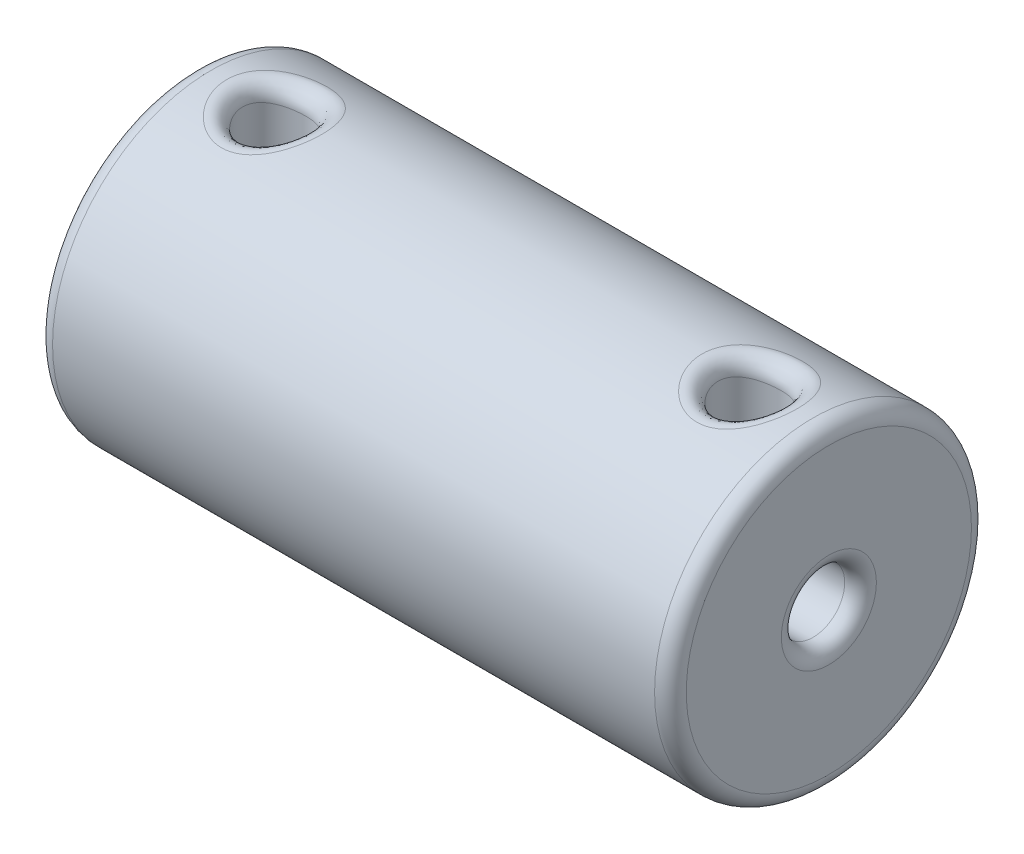
from build123d import *

# Parameters (mm, degrees)
BOSS_EXTRUDE1_DEPTH      = 10
BOSS_EXTRUDE1_DEPTH_BACK = 10
SKETCH1_R                = 5
SKETCH2_R                = 1
CUT_EXTRUDE1_DEPTH       = 10
SKETCH3_R                = 2
CUT_EXTRUDE2_DEPTH       = 10
CUT_EXTRUDE4_REACH       = 14.247
SKETCH4_R                = 1
FILLET1_R                = 0.5
FILLET2_R                = 0.5


with BuildPart() as part:
    # Sketch1 → Boss-Extrude1 (new, two sides: drawn at the far end of the back side and taken through both)
    with BuildSketch(Plane(origin=(0, 0, 0), x_dir=(0, 0, -1), z_dir=(1, 0, 0)).offset(-BOSS_EXTRUDE1_DEPTH_BACK)):
        Circle(SKETCH1_R)
    extrude(amount=BOSS_EXTRUDE1_DEPTH + BOSS_EXTRUDE1_DEPTH_BACK)

    # Sketch2 → Cut-Extrude1 (cut)
    with BuildSketch(Plane(origin=(10, 0, 0), x_dir=(0, 0, -1), z_dir=(1, 0, 0))):
        Circle(SKETCH2_R)
    extrude(amount=-CUT_EXTRUDE1_DEPTH, mode=Mode.SUBTRACT)

    # Sketch3 → Cut-Extrude2 (cut)
    with BuildSketch(Plane.ZY.offset(10)):
        Circle(SKETCH3_R)
    extrude(amount=-CUT_EXTRUDE2_DEPTH, mode=Mode.SUBTRACT)

    # Sketch4 → Cut-Extrude4 (cut, up to next)
    with BuildSketch(Plane(origin=(0, 0, 0), x_dir=(1, 0, 0), z_dir=(0, 1, 0)), mode=Mode.PRIVATE) as cut_extrude4_sk1:
        with Locations((-7.5, 0)):
            Circle(SKETCH4_R)
    cut_extrude4_tool1 = extrude(cut_extrude4_sk1.sketch, amount=CUT_EXTRUDE4_REACH, mode=Mode.PRIVATE) & part.part
    # Sketch4 → Cut-Extrude4 (cut, up to next)
    with BuildSketch(Plane(origin=(0, 0, 0), x_dir=(1, 0, 0), z_dir=(0, 1, 0)), mode=Mode.PRIVATE) as cut_extrude4_sk2:
        with Locations((7.5, 0)):
            Circle(SKETCH4_R)
    cut_extrude4_tool2 = extrude(cut_extrude4_sk2.sketch, amount=CUT_EXTRUDE4_REACH, mode=Mode.PRIVATE) & part.part
    add(cut_extrude4_tool1.solids().sort_by_distance((-7.5, 0, 0))[0], mode=Mode.SUBTRACT)
    add(cut_extrude4_tool2.solids().sort_by_distance((7.5, 0, 0))[0], mode=Mode.SUBTRACT)

    # Fillet1
    fillet1_edges = [part.edges().sort_by_distance(p)[0] for p in [
        (10, 0, 1),
        (10, 0, 5),
        (-10, 0, 5),
        (-10, 0, -2),
    ]]
    fillet(fillet1_edges, radius=FILLET1_R)

    # Fillet2
    fillet2_edges = [part.edges().sort_by_distance(p)[0] for p in [
        (6.5, 5, 0),
        (-8.5, 5, 0),
    ]]
    fillet(fillet2_edges, radius=FILLET2_R)


solid = part.part
